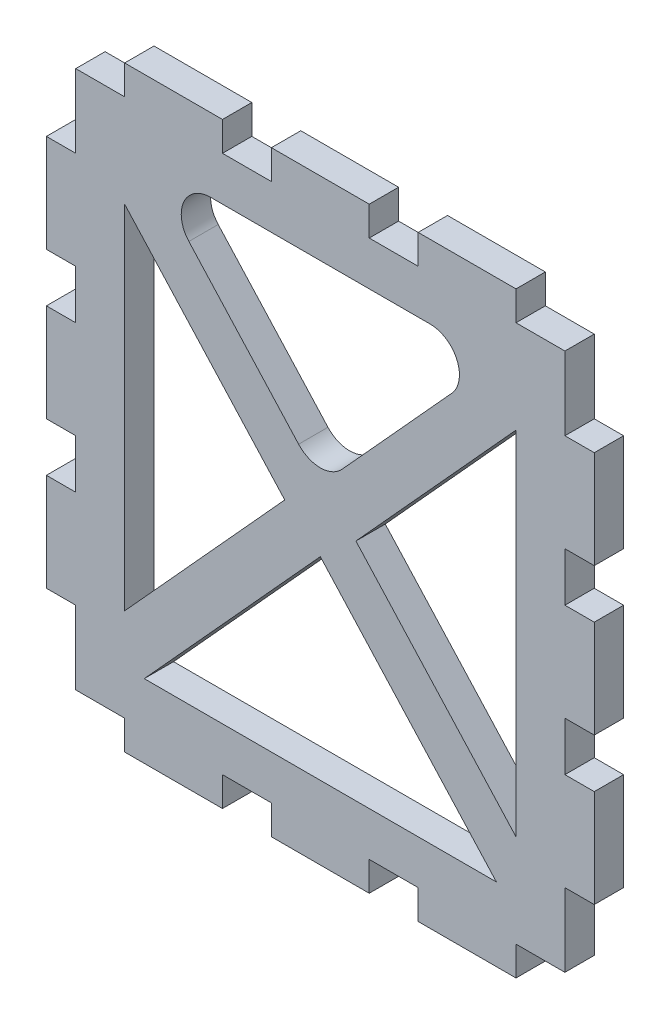
from build123d import *

# Parameters (mm, degrees)
EXTRUDE_1_DEPTH     = 3
CUT_EXTRUDE_1_DEPTH = 10
FILLET_2_R          = 3


with BuildPart() as part:
    # 草图1 → 凸台-拉伸1 (new body)
    with BuildSketch(Plane.XY):
        Polygon((-25, 27.5), (-20, 27.5), (-20, 30.5), (-10, 30.5), (-10, 27.5), (-5, 27.5), (-5, 30.5), (5, 30.5), (5, 27.5), (10, 27.5), (10, 30.5), (20, 30.5), (20, 27.5), (25, 27.5), (25, 20), (28, 20), (28, 10), (25, 10), (25, 5), (28, 5), (28, -5), (25, -5), (25, -10), (28, -10), (28, -20), (25, -20), (25, -27.5), (20, -27.5), (20, -30.5), (10, -30.5), (10, -27.5), (5, -27.5), (5, -30.5), (-5, -30.5), (-5, -27.5), (-10, -27.5), (-10, -30.5), (-20, -30.5), (-20, -27.5), (-25, -27.5), (-25, -20), (-28, -20), (-28, -10), (-25, -10), (-25, -5), (-28, -5), (-28, 5), (-25, 5), (-25, 10), (-28, 10), (-28, 20), (-25, 20), align=None)
    extrude(amount=EXTRUDE_1_DEPTH)

    # 草图2 → 切除-拉伸1 (cut)
    with BuildSketch(Plane.XY.offset(3)):
        Polygon((-18, 23), (18, 23), (0, 3.2), align=None)
        Polygon((-18, -23), (18, -23), (0, -3.2), align=None)
        Polygon((20, 18), (20, -18), (3.636363636, 0), align=None)
        Polygon((-20, 18), (-3.636363636, 0), (-20, -18), align=None)
    extrude(amount=-CUT_EXTRUDE_1_DEPTH, mode=Mode.SUBTRACT)

    # 圆角2
    fillet_2_edges = [part.edges().sort_by_distance(p)[0] for p in [
        (18, 23, 1.5),
        (0, 3.2, 1.5),
        (-18, 23, 1.5),
    ]]
    fillet(fillet_2_edges, radius=FILLET_2_R)


solid = part.part
